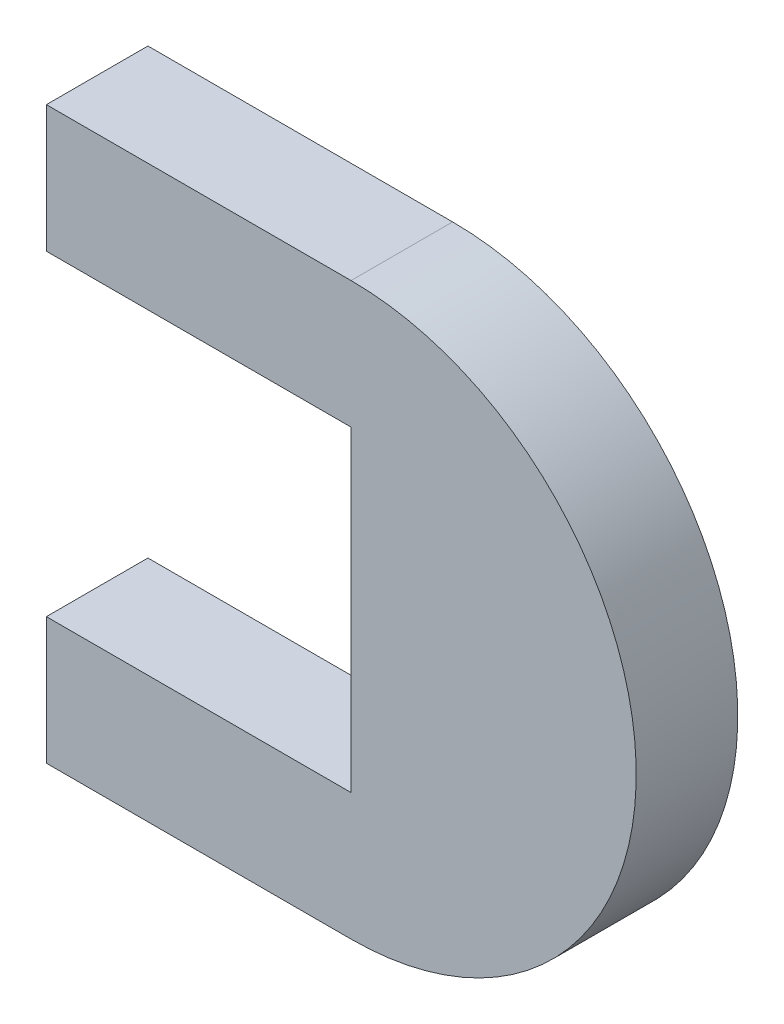
from build123d import *

# Parameters (mm, degrees)
BOSS_EXTRUDE1_DEPTH = 10


with BuildPart() as part:
    # Sketch1 → Boss-Extrude1 (new body)
    with BuildSketch(Plane.XY):
        with BuildLine():
            Line((-30, 15.58), (0, 15.58))
            Line((0, 15.58), (0, -15.58))
            Line((0, -15.58), (-30, -15.58))
            Line((-30, -15.58), (-30, -28.08))
            Line((-30, -28.08), (0, -28.08))
            ThreePointArc((0, -28.08), (28.08, 0), (0, 28.08))
            Line((0, 28.08), (-30, 28.08))
            Line((-30, 28.08), (-30, 15.58))
        make_face()
    extrude(amount=BOSS_EXTRUDE1_DEPTH)


solid = part.part
